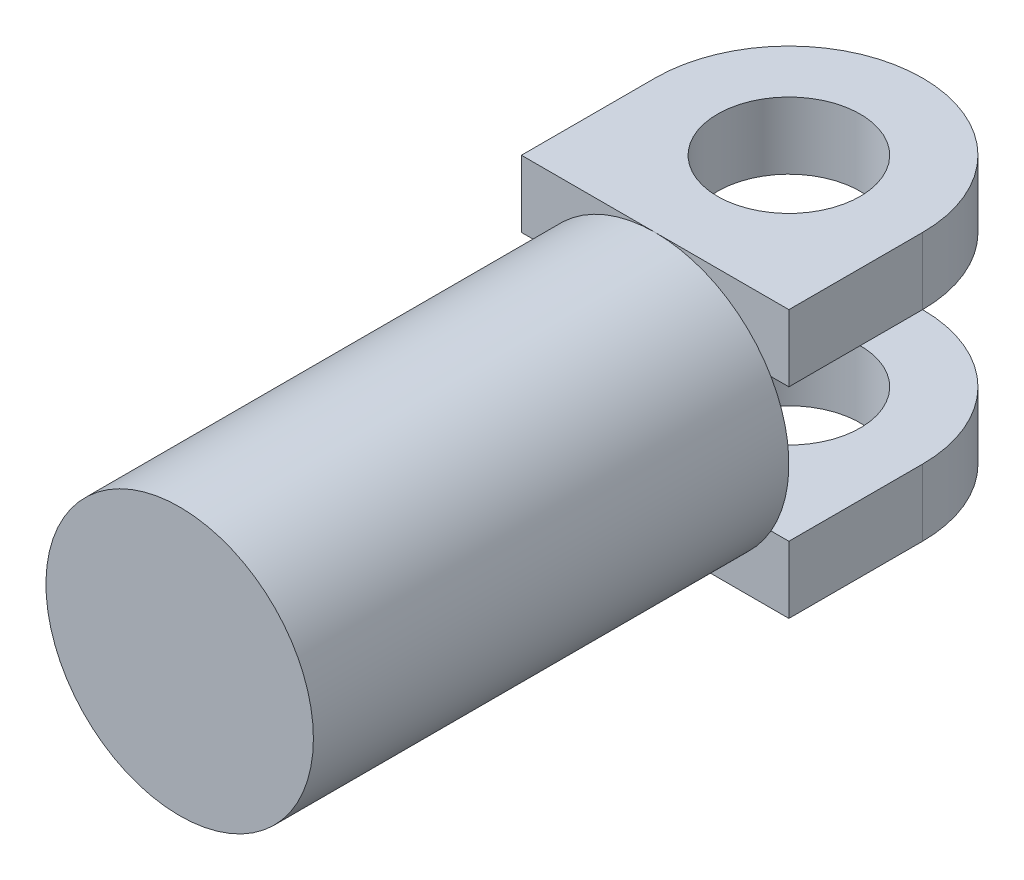
from build123d import *

# Parameters (mm, degrees)
SKETCH1_R                = 90
BOSS_EXTRUDE1_DEPTH      = 320
BOSS_EXTRUDE2_DEPTH      = 90
BOSS_EXTRUDE2_DEPTH_BACK = 90
SKETCH2_R                = 48
SKETCH3_W                = 213.4354408
SKETCH3_H                = 90
CUT_EXTRUDE1_DEPTH       = 663


with BuildPart() as part:
    # Sketch1 → Boss-Extrude1 (new body)
    with BuildSketch(Plane.XY):
        Circle(SKETCH1_R)
    extrude(amount=BOSS_EXTRUDE1_DEPTH)

    # Sketch2 → Boss-Extrude2 (add, two sides: drawn at the far end of the back side and taken through both)
    with BuildSketch(Plane(origin=(0, 0, 0), x_dir=(1, 0, 0), z_dir=(0, 1, 0)).offset(-BOSS_EXTRUDE2_DEPTH_BACK)):
        with BuildLine():
            Line((90, 0), (90, 90))
            ThreePointArc((90, 90), (0, 180), (-90, 90))
            Line((-90, 90), (-90, 0))
            Line((-90, 0), (0, 0))
            Line((0, 0), (90, 0))
        make_face()
        with Locations((0, 90)):
            Circle(SKETCH2_R, mode=Mode.SUBTRACT)
    extrude(amount=BOSS_EXTRUDE2_DEPTH + BOSS_EXTRUDE2_DEPTH_BACK)

    # Sketch3 → Cut-Extrude1 (cut)
    with BuildSketch(Plane.ZY.offset(90)):
        with Locations((-106.7177204, 0)):
            Rectangle(SKETCH3_W, SKETCH3_H)
    extrude(amount=-CUT_EXTRUDE1_DEPTH, mode=Mode.SUBTRACT)


solid = part.part
